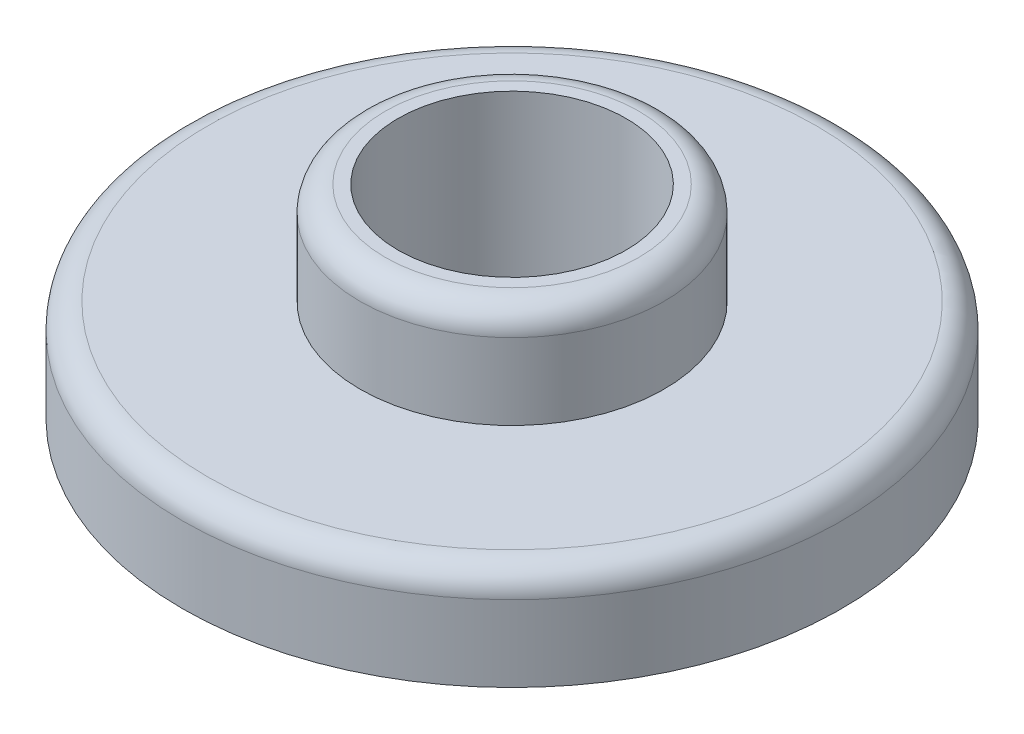
from build123d import *

# Parameters (mm, degrees)
SKETCH_1_R          = 6.5
EXTRUDE_1_DEPTH     = 2
SKETCH_2_R          = 3
EXTRUDE_2_DEPTH     = 2
SKETCH_3_R          = 2.25
CUT_EXTRUDE_1_DEPTH = 10
FILLET_2_R          = 0.5
FILLET_3_R          = 0.5


with BuildPart() as part:
    # 草图1 → 凸台-拉伸1 (new body)
    with BuildSketch(Plane(origin=(0, 0, 0), x_dir=(1, 0, 0), z_dir=(0, 1, 0))):
        with Locations(Location((0, 0, 0), (0, 0, 270))):
            Circle(SKETCH_1_R)
    extrude(amount=EXTRUDE_1_DEPTH)

    # 草图2 → 凸台-拉伸2 (add)
    with BuildSketch(Plane(origin=(0, 2, 0), x_dir=(1, 0, 0), z_dir=(0, 1, 0))):
        with Locations(Location((0, 0, 0), (0, 0, 270))):
            Circle(SKETCH_2_R)
    extrude(amount=EXTRUDE_2_DEPTH)

    # 草图3 → 切除-拉伸1 (cut)
    with BuildSketch(Plane(origin=(0, 4, 0), x_dir=(1, 0, 0), z_dir=(0, 1, 0))):
        with Locations(Location((0, 0, 0), (0, 0, 270))):
            Circle(SKETCH_3_R)
    extrude(amount=-CUT_EXTRUDE_1_DEPTH, mode=Mode.SUBTRACT)

    # 圆角2
    fillet_2_edges = [part.edges().sort_by_distance(p)[0] for p in [
        (0, 4, -3),
    ]]
    fillet(fillet_2_edges, radius=FILLET_2_R)

    # 圆角3
    fillet_3_edges = [part.edges().sort_by_distance(p)[0] for p in [
        (0, 2, -6.5),
    ]]
    fillet(fillet_3_edges, radius=FILLET_3_R)


solid = part.part
